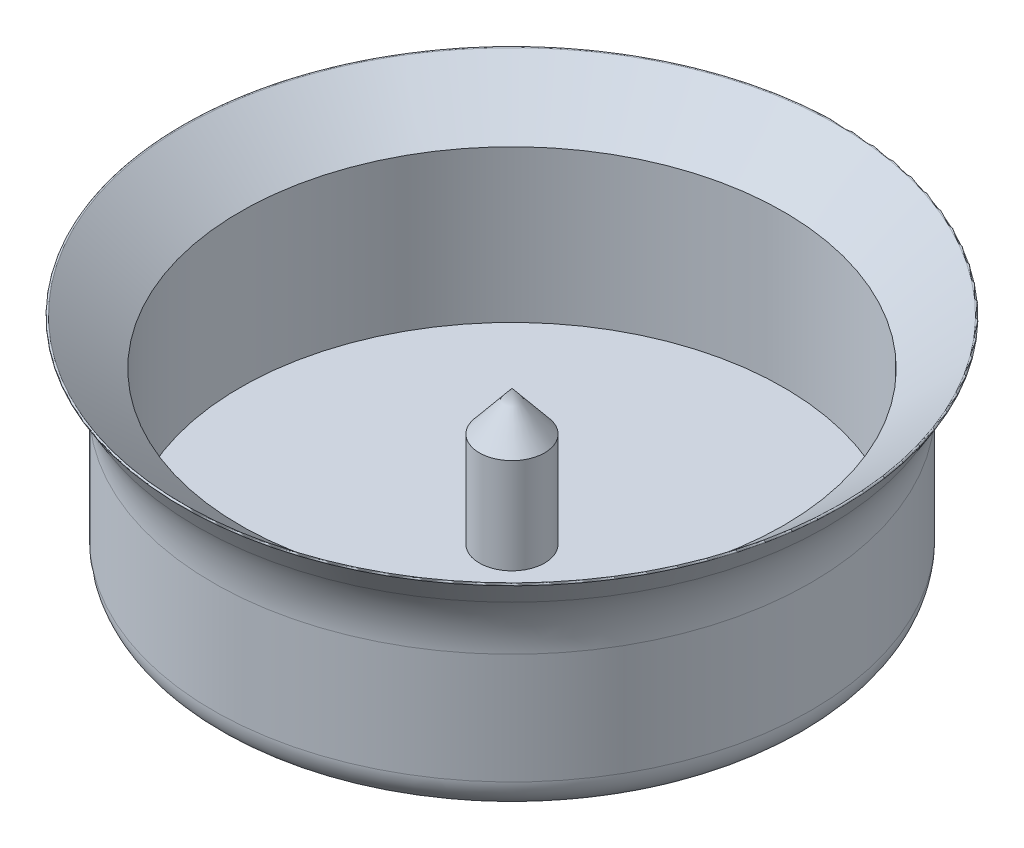
from build123d import *

# Parameters (mm, degrees)
FILLET1_R = 10
FILLET2_R = 3
FILLET3_R = 0.1


with BuildPart() as part:
    # Sketch1 → Revolve1 (revolve)
    with BuildSketch(Plane.XY):
        Polygon((0, 0), (0, 14.929960222), (3, 11.285019889), (3, 2.5), (25, 2.5), (25, 16.5), (30.61017272, 21.117501694), (27.5, 15.957901724), (27.5, 0), (11.962132927, 0), align=None)
    revolve(axis=Axis((0, 0, 0), (0, 1, 0)))

    # Fillet1
    fillet1_edges = [part.edges().sort_by_distance(p)[0] for p in [
        (-27.5, 15.957901724, 0),
    ]]
    fillet(fillet1_edges, radius=FILLET1_R)

    # Fillet2
    fillet2_edges = [part.edges().sort_by_distance(p)[0] for p in [
        (-27.5, 0, 0),
    ]]
    fillet(fillet2_edges, radius=FILLET2_R)

    # Fillet3
    fillet3_edges = [part.edges().sort_by_distance(p)[0] for p in [
        (-30.61017272, 21.117501694, 0),
    ]]
    fillet(fillet3_edges, radius=FILLET3_R)


solid = part.part
